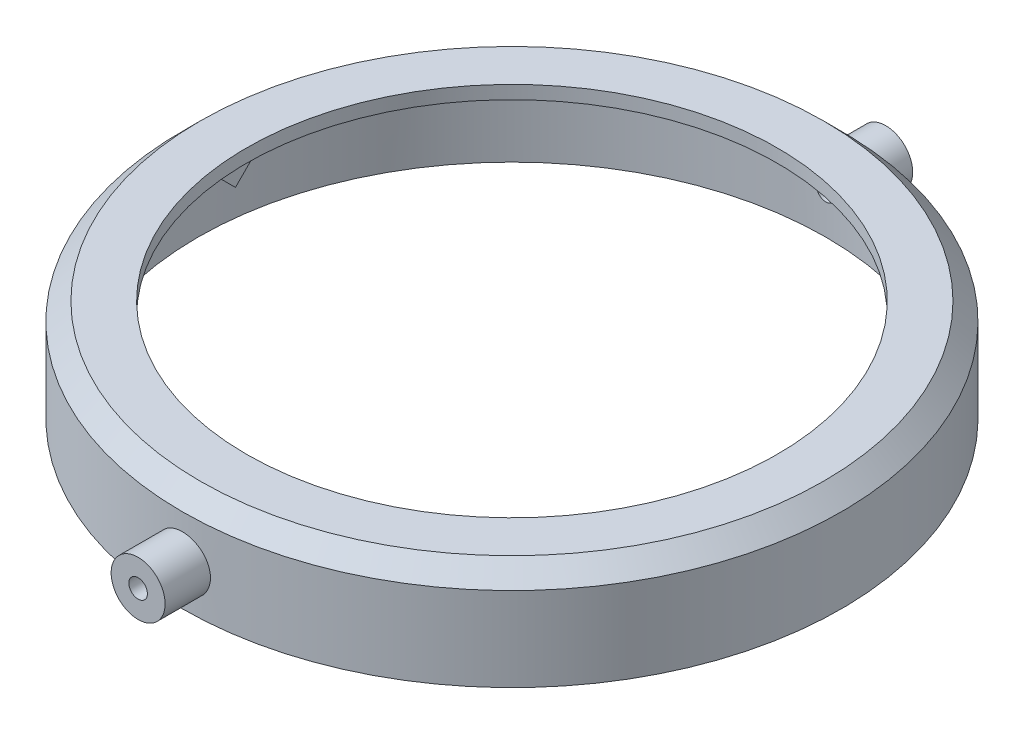
from build123d import *

# Parameters (mm, degrees)
SKETCH1_R           = 37.25
SKETCH1_R_2         = 35.5
BOSS_EXTRUDE1_DEPTH = 10
BOSS_EXTRUDE2_START = 1.5
SKETCH1_2_R         = 37.25
SKETCH1_2_R_2       = 30
BOSS_EXTRUDE2_DEPTH = 1.5
CHAMFER1_SIZE       = 1.5
CHAMFER2_SIZE       = 2
SKETCH2_R           = 1.05
CUT_EXTRUDE1_DEPTH  = 10
BOSS_EXTRUDE4_START = 5
SKETCH2_3_R         = 3.05
SKETCH2_3_R_2       = 1.05
BOSS_EXTRUDE4_DEPTH = 6
BOSS_EXTRUDE6_START = -1
BOSS_EXTRUDE6_DEPTH = 5


with BuildPart() as part:
    # Sketch1 → Boss-Extrude1 (new body)
    with BuildSketch(Plane(origin=(0, 0, 0), x_dir=(1, 0, 0), z_dir=(0, 1, 0))):
        Circle(SKETCH1_R)
        Circle(SKETCH1_R_2, mode=Mode.SUBTRACT)
    extrude(amount=-BOSS_EXTRUDE1_DEPTH)

    # Sketch1<2> → Boss-Extrude2 (add)
    with BuildSketch(Plane(origin=(0, 0, 0), x_dir=(1, 0, 0), z_dir=(0, 1, 0)).offset(BOSS_EXTRUDE2_START)):
        Circle(SKETCH1_2_R)
        Circle(SKETCH1_2_R_2, mode=Mode.SUBTRACT)
    extrude(amount=-BOSS_EXTRUDE2_DEPTH)

    # Chamfer1
    chamfer1_edges = [part.edges().sort_by_distance(p)[0] for p in [
        (-35.5, 0, 0),
    ]]
    chamfer(chamfer1_edges, length=CHAMFER1_SIZE)

    # Chamfer2
    chamfer2_edges = [part.edges().sort_by_distance(p)[0] for p in [
        (-37.25, 1.5, 0),
    ]]
    chamfer(chamfer2_edges, length=CHAMFER2_SIZE)

    # Sketch2 → Cut-Extrude1 (cut)
    with BuildSketch(Plane.XY.offset(37.25)):
        with Locations((0, -5.5)):
            Circle(SKETCH2_R)
    cut_extrude1 = extrude(amount=-CUT_EXTRUDE1_DEPTH, mode=Mode.SUBTRACT)

    # Sketch2<3> → Boss-Extrude4 (add)
    with BuildSketch(Plane.XY.offset(37.25).offset(BOSS_EXTRUDE4_START)):
        with Locations((0, -5.5)):
            Circle(SKETCH2_3_R)
        with Locations((0, -5.5)):
            Circle(SKETCH2_3_R_2, mode=Mode.SUBTRACT)
    boss_extrude4 = extrude(amount=-BOSS_EXTRUDE4_DEPTH)

    # Mirror1: Cut-Extrude1, Boss-Extrude4 across plane
    add(cut_extrude1.mirror(Plane.XY), mode=Mode.SUBTRACT)
    add(boss_extrude4.mirror(Plane.XY))

    # tirangle → Boss-Extrude6 (add)
    with BuildSketch(Plane(origin=(37.25, 0, 0), x_dir=(0, 0, -1), z_dir=(1, 0, 0)).offset(BOSS_EXTRUDE6_START)):
        Polygon((2.5, -0.5), (-2.5, -0.5), (0, -3), align=None)
    boss_extrude6 = extrude(amount=-BOSS_EXTRUDE6_DEPTH)

    # Mirror2: Boss-Extrude6 across plane
    add(boss_extrude6.mirror(Plane(origin=(0, 0, 0), x_dir=(0, 0, 1), z_dir=(1, 0, 0))))


solid = part.part
